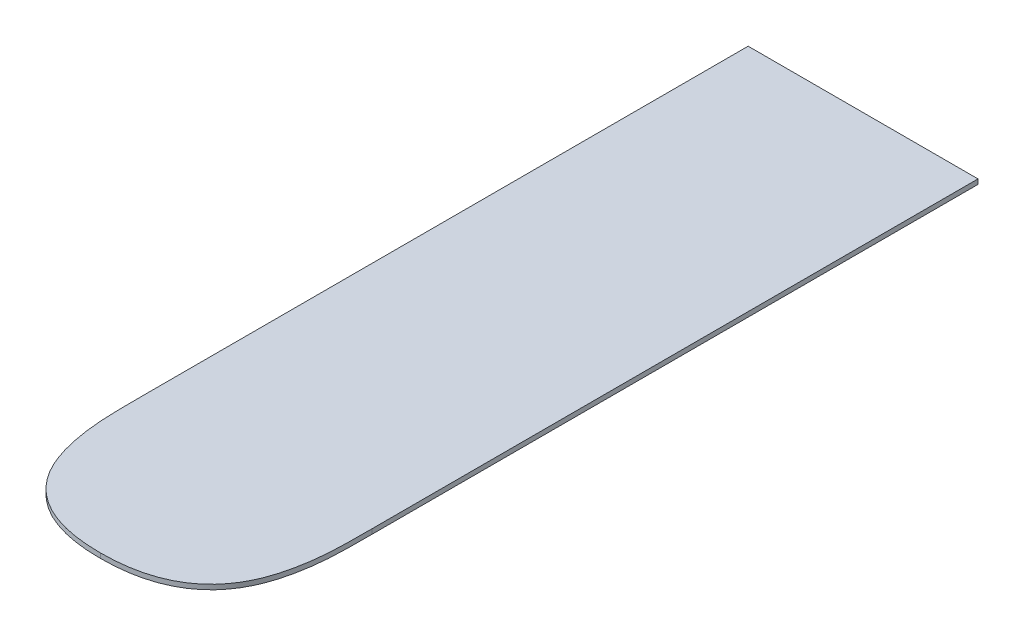
from build123d import *

# Parameters (mm, degrees)
BOSS_EXTRUDE1_DEPTH = 5.842
SKETCH4_W           = 139.7
SKETCH4_H           = 914.4
CUT_EXTRUDE1_DEPTH  = 1468.177722461


with BuildPart() as part:
    # Sketch3 → Boss-Extrude1 (new body)
    with BuildSketch(Plane(origin=(0, 0, 0), x_dir=(1, 0, 0), z_dir=(0, 1, 0))):
        with BuildLine():
            Line((0, 381), (0, -1460.5))
            add(Edge.make_bspline(
                [(0, -1460.5), (108.684994241, -1460.5), (137.201191705, -1361.385263755), (139.7, -1312.037784968), (139.7, -1270)],
                knots=[0, 0, 0, 0, 0.140310505, 0.200610012, 0.200610012, 0.200610012, 0.200610012], degree=3))
            Line((139.7, -1270), (139.7, 63.5))
            add(Edge.make_bspline(
                [(139.7, 63.5), (139.7, 105.409860509), (138.775867716, 206.495657368), (73.507849515, 381), (0, 381)],
                knots=[0.803817555, 0.803817555, 0.803817555, 0.803817555, 0.866735408, 1, 1, 1, 1], degree=3))
        make_face()
    extrude(amount=BOSS_EXTRUDE1_DEPTH)

    # Sketch4 → Cut-Extrude1 (cut, through all)
    with BuildSketch(Plane(origin=(0, 0, 0), x_dir=(1, 0, 0), z_dir=(0, 1, 0))):
        with Locations((69.85, -76.2)):
            Rectangle(SKETCH4_W, SKETCH4_H)
    extrude(amount=CUT_EXTRUDE1_DEPTH, mode=Mode.SUBTRACT)

    # Mirror1: part across plane


with BuildPart() as part_1:
    add(part.part)
    add(part.part.mirror(Plane(origin=(0, 0, 0), x_dir=(0, 0, 1), z_dir=(1, 0, 0))))


solid = part_1.part
